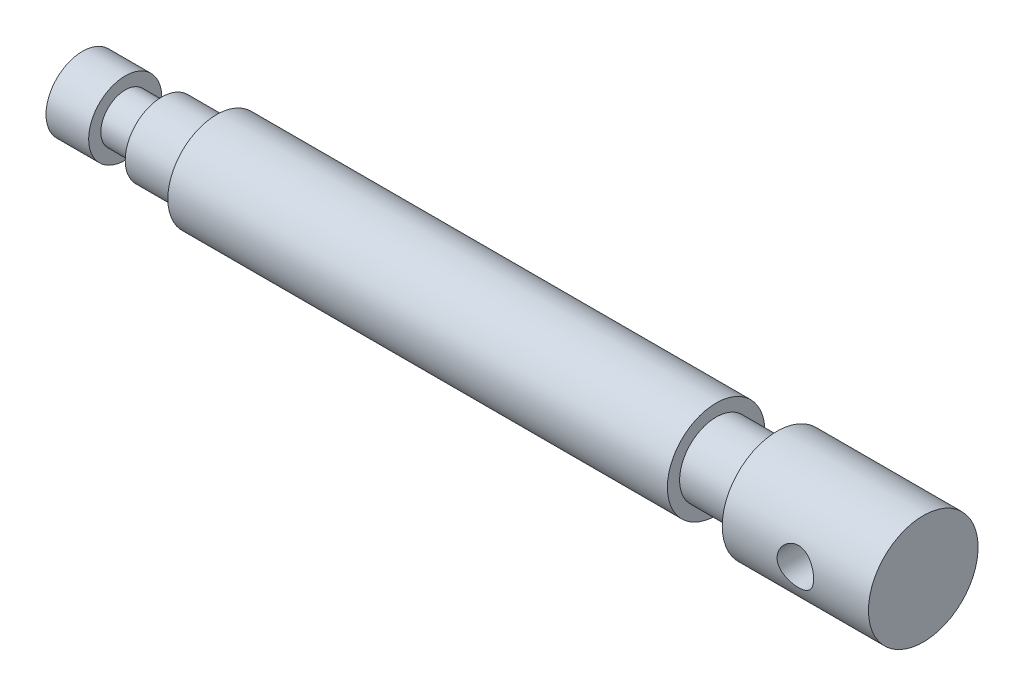
from build123d import *

# Parameters (mm, degrees)
CUT_EXTRUDE1_DEPTH      = 20
CUT_EXTRUDE1_DEPTH_BACK = 20
SKETCH2_R               = 3


with BuildPart() as part:
    # Sketch1 → Revolve1 (revolve)
    with BuildSketch(Plane.XY, mode=Mode.PRIVATE) as revolve1_sk:
        Polygon((-134.848431633, 0), (-134.848431633, 6), (-127.848431633, 6), (-127.848431633, 4), (-121.848431633, 4), (-121.848431633, 6), (-112.848431633, 6), (-112.848431633, 8), (-30.848431633, 8), (-30.848431633, 6), (-20.848431633, 6), (-20.848431633, 9), (3.151568367, 9), (3.151568367, 0), align=None)
    revolve(revolve1_sk.sketch.rotate(Axis((-164.248525739, 0, 0), (1, 0, 0)), 90), axis=Axis((-164.248525739, 0, 0), (1, 0, 0)))

    # Sketch2 → Cut-Extrude1 (cut, two sides: drawn at the far end of the back side and taken through both)
    with BuildSketch(Plane.XY.offset(-CUT_EXTRUDE1_DEPTH_BACK)):
        with Locations((-8.848431633, 0)):
            Circle(SKETCH2_R)
    extrude(amount=CUT_EXTRUDE1_DEPTH + CUT_EXTRUDE1_DEPTH_BACK, mode=Mode.SUBTRACT)


solid = part.part
